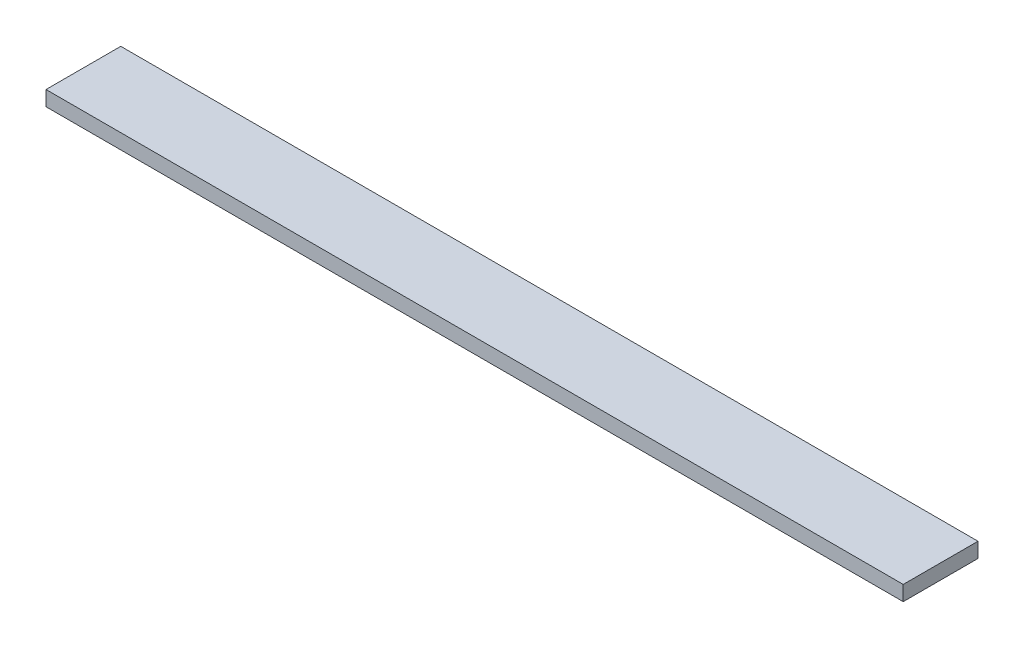
from build123d import *

# Parameters (mm, degrees)
SKETCH_1_W      = 114.63
SKETCH_1_H      = 10
EXTRUDE_1_DEPTH = 2


with BuildPart() as part:
    # 草图1 → 凸台-拉伸1 (new body)
    with BuildSketch(Plane(origin=(0, 0, 0), x_dir=(1, 0, 0), z_dir=(0, 1, 0))):
        with Locations((20.151516418, 7.764848709)):
            Rectangle(SKETCH_1_W, SKETCH_1_H)
    extrude(amount=EXTRUDE_1_DEPTH)


solid = part.part
